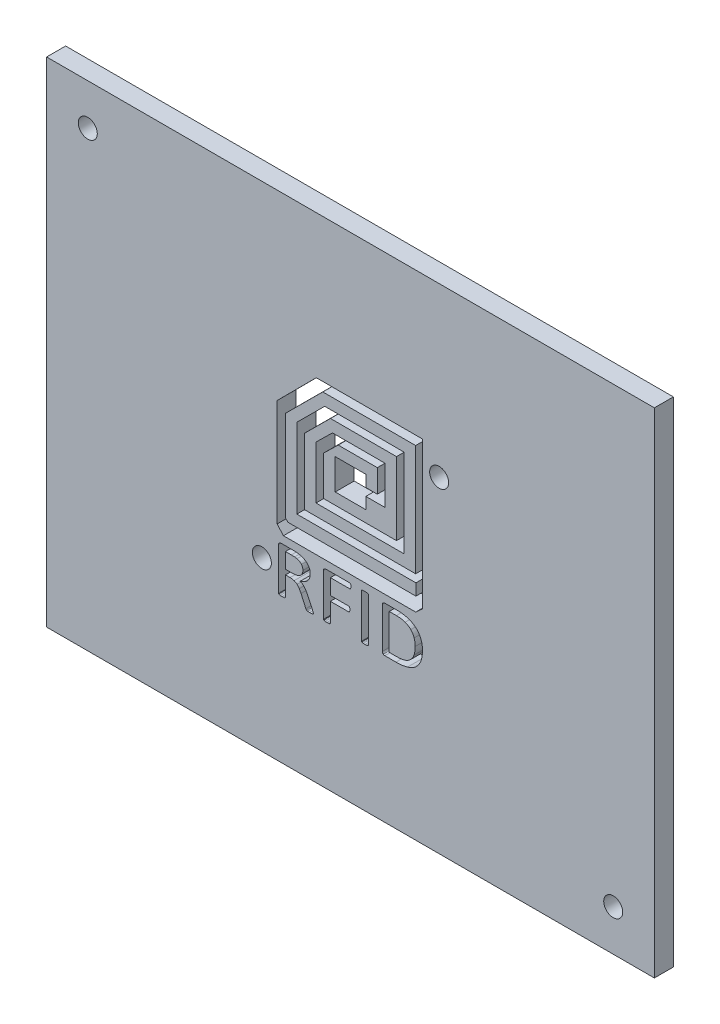
from build123d import *

# Parameters (mm, degrees)
CROQUIS1_W              = 96
CROQUIS1_H              = 78
SALIENTE_EXTRUIR2_DEPTH = 3
CROQUIS2_OUTSIDE_W      = 122.746
CROQUIS2_OUTSIDE_H      = 104.746
CROQUIS2_OUTSIDE_W_2    = 96
CROQUIS2_OUTSIDE_H_2    = 78
CROQUIS2_OUTSIDE_R      = 1.5
CORTAR_EXTRUIR1_DEPTH   = 62.919302322
CORTAR_EXTRUIR9_DEPTH   = 10


with BuildPart() as part:
    # Croquis1 → Saliente-Extruir2 (new body)
    with BuildSketch(Plane.XY):
        Rectangle(CROQUIS1_W, CROQUIS1_H)
    extrude(amount=-SALIENTE_EXTRUIR2_DEPTH)

    # Croquis2 outside → Cortar-Extruir1 (cut, through all)
    # profile 1 of 5: a face of its own
    with BuildSketch(Plane.XY):
        Rectangle(CROQUIS2_OUTSIDE_W, CROQUIS2_OUTSIDE_H)
        Rectangle(CROQUIS2_OUTSIDE_W_2, CROQUIS2_OUTSIDE_H_2, mode=Mode.SUBTRACT)
    # profile 2 of 5: a face of its own
    with BuildSketch(Plane.XY):
        with Locations((-14, -12.5)):
            Circle(CROQUIS2_OUTSIDE_R)
    # profile 3 of 5: a face of its own
    with BuildSketch(Plane.XY):
        with Locations((14, 12.5)):
            Circle(CROQUIS2_OUTSIDE_R)
    # profile 4 of 5: a face of its own
    with BuildSketch(Plane.XY):
        with Locations((-41.5, 32.5)):
            Circle(CROQUIS2_OUTSIDE_R)
    # profile 5 of 5: a face of its own
    with BuildSketch(Plane.XY):
        with Locations((41.5, -32.5)):
            Circle(CROQUIS2_OUTSIDE_R)
    extrude(amount=-CORTAR_EXTRUIR1_DEPTH, mode=Mode.SUBTRACT)

    # Sketch6 → Cortar-Extruir9 (cut)
    # profile 1 of 5: a face of its own
    with BuildSketch(Plane.XY):
        with BuildLine():
            Line((1.727462, -9.152641), (1.727462, -16.05162))
            add(Edge.make_bspline(
                [(1.727462, -16.05162), (1.727462, -16.081137), (1.738769, -16.106227), (1.755729, -16.128365)],
                knots=[0, 0, 0, 0, 1, 1, 1, 1], degree=3))
            add(Edge.make_bspline(
                [(1.755729, -16.128365), (1.77269, -16.150504), (1.801522, -16.171166), (1.843922, -16.185925)],
                knots=[0, 0, 0, 0, 1, 1, 1, 1], degree=3))
            add(Edge.make_bspline(
                [(1.843922, -16.185925), (1.886323, -16.198224), (1.942856, -16.203143), (2.014937, -16.210523)],
                knots=[0, 0, 0, 0, 1, 1, 1, 1], degree=3))
            add(Edge.make_bspline(
                [(2.014937, -16.210523), (2.0873, -16.222822), (2.177754, -16.230201), (2.279798, -16.230201)],
                knots=[0, 0, 0, 0, 1, 1, 1, 1], degree=3))
            add(Edge.make_bspline(
                [(2.279798, -16.230201), (2.386082, -16.230201), (2.471165, -16.222822), (2.539288, -16.210523)],
                knots=[0, 0, 0, 0, 1, 1, 1, 1], degree=3))
            add(Edge.make_bspline(
                [(2.539288, -16.210523), (2.611652, -16.203143), (2.667903, -16.198224), (2.710303, -16.185925)],
                knots=[0, 0, 0, 0, 1, 1, 1, 1], degree=3))
            add(Edge.make_bspline(
                [(2.710303, -16.185925), (2.752986, -16.171166), (2.781536, -16.150504), (2.798496, -16.128365)],
                knots=[0, 0, 0, 0, 1, 1, 1, 1], degree=3))
            add(Edge.make_bspline(
                [(2.798496, -16.128365), (2.815456, -16.106227), (2.826763, -16.081137), (2.826763, -16.05162)],
                knots=[0, 0, 0, 0, 1, 1, 1, 1], degree=3))
            Line((2.826763, -16.05162), (2.826763, -9.152641))
            add(Edge.make_bspline(
                [(2.826763, -9.152641), (2.826763, -9.123123), (2.815456, -9.098033), (2.798496, -9.075895)],
                knots=[0, 0, 0, 0, 1, 1, 1, 1], degree=3))
            add(Edge.make_bspline(
                [(2.798496, -9.075895), (2.781536, -9.053757), (2.752704, -9.034079), (2.710303, -9.023009)],
                knots=[0, 0, 0, 0, 1, 1, 1, 1], degree=3))
            add(Edge.make_bspline(
                [(2.710303, -9.023009), (2.66762, -9.008251), (2.611369, -8.99669), (2.539288, -8.98931)],
                knots=[0, 0, 0, 0, 1, 1, 1, 1], degree=3))
            Line((2.539288, -8.98931), (2.279798, -8.974551))
            add(Edge.make_bspline(
                [(2.279798, -8.974551), (2.182277, -8.974551), (2.092954, -8.977011), (2.02059, -8.98931)],
                knots=[0, 0, 0, 0, 1, 1, 1, 1], degree=3))
            add(Edge.make_bspline(
                [(2.02059, -8.98931), (1.952467, -8.99669), (1.896216, -9.008989), (1.849576, -9.023009)],
                knots=[0, 0, 0, 0, 1, 1, 1, 1], degree=3))
            add(Edge.make_bspline(
                [(1.849576, -9.023009), (1.806892, -9.035308), (1.77693, -9.053757), (1.755729, -9.075895)],
                knots=[0, 0, 0, 0, 1, 1, 1, 1], degree=3))
            add(Edge.make_bspline(
                [(1.755729, -9.075895), (1.738769, -9.098033), (1.727462, -9.123123), (1.727462, -9.152641)],
                knots=[0, 0, 0, 0, 1, 1, 1, 1], degree=3))
        make_face()
    # profile 2 of 5: a face of its own
    with BuildSketch(Plane.XY):
        with BuildLine():
            Line((-11.372982, -9.397514), (-11.372982, -16.051472))
            add(Edge.make_bspline(
                [(-11.372982, -16.051472), (-11.372982, -16.08099), (-11.367329, -16.10608), (-11.350369, -16.128218)],
                knots=[0, 0, 0, 0, 1, 1, 1, 1], degree=3))
            add(Edge.make_bspline(
                [(-11.350369, -16.128218), (-11.333408, -16.150356), (-11.299205, -16.171018), (-11.256522, -16.185777)],
                knots=[0, 0, 0, 0, 1, 1, 1, 1], degree=3))
            add(Edge.make_bspline(
                [(-11.256522, -16.185777), (-11.213839, -16.198076), (-11.159001, -16.202996), (-11.090878, -16.210375)],
                knots=[0, 0, 0, 0, 1, 1, 1, 1], degree=3))
            add(Edge.make_bspline(
                [(-11.090878, -16.210375), (-11.018515, -16.222674), (-10.932301, -16.230054), (-10.826017, -16.230054)],
                knots=[0, 0, 0, 0, 1, 1, 1, 1], degree=3))
            add(Edge.make_bspline(
                [(-10.826017, -16.230054), (-10.719734, -16.230054), (-10.628997, -16.222674), (-10.561156, -16.210375)],
                knots=[0, 0, 0, 0, 1, 1, 1, 1], degree=3))
            add(Edge.make_bspline(
                [(-10.561156, -16.210375), (-10.488793, -16.202996), (-10.433672, -16.198076), (-10.395512, -16.185777)],
                knots=[0, 0, 0, 0, 1, 1, 1, 1], degree=3))
            add(Edge.make_bspline(
                [(-10.395512, -16.185777), (-10.352829, -16.171018), (-10.324279, -16.150356), (-10.307319, -16.128218)],
                knots=[0, 0, 0, 0, 1, 1, 1, 1], degree=3))
            add(Edge.make_bspline(
                [(-10.307319, -16.128218), (-10.284706, -16.10608), (-10.274247, -16.08099), (-10.274247, -16.051472)],
                knots=[0, 0, 0, 0, 1, 1, 1, 1], degree=3))
            Line((-10.274247, -16.051472), (-10.274247, -12.991136))
            Line((-10.274247, -12.991136), (-9.539957, -12.991136))
            add(Edge.make_bspline(
                [(-9.539957, -12.991136), (-9.288947, -12.991136), (-9.078245, -13.025327), (-8.899542, -13.091987)],
                knots=[0, 0, 0, 0, 1, 1, 1, 1], degree=3))
            add(Edge.make_bspline(
                [(-8.899542, -13.091987), (-8.720895, -13.154958), (-8.562176, -13.242527), (-8.430255, -13.36104)],
                knots=[0, 0, 0, 0, 1, 1, 1, 1], degree=3))
            add(Edge.make_bspline(
                [(-8.430255, -13.36104), (-8.298248, -13.475913), (-8.187159, -13.616097), (-8.093482, -13.77901)],
                knots=[0, 0, 0, 0, 1, 1, 1, 1], degree=3))
            add(Edge.make_bspline(
                [(-8.093482, -13.77901), (-7.995679, -13.938159), (-7.901267, -14.114945), (-7.811944, -14.307498)],
                knots=[0, 0, 0, 0, 1, 1, 1, 1], degree=3))
            Line((-7.811944, -14.307498), (-7.055606, -15.998611))
            add(Edge.make_bspline(
                [(-7.055606, -15.998611), (-7.038646, -16.043133), (-7.016032, -16.079538), (-6.994832, -16.109056)],
                knots=[0, 0, 0, 0, 1, 1, 1, 1], degree=3))
            add(Edge.make_bspline(
                [(-6.994832, -16.109056), (-6.969392, -16.138574), (-6.938016, -16.167353), (-6.895333, -16.185802)],
                knots=[0, 0, 0, 0, 1, 1, 1, 1], degree=3))
            add(Edge.make_bspline(
                [(-6.895333, -16.185802), (-6.852932, -16.200561), (-6.797812, -16.20794), (-6.729688, -16.214582)],
                knots=[0, 0, 0, 0, 1, 1, 1, 1], degree=3))
            add(Edge.make_bspline(
                [(-6.729688, -16.214582), (-6.657325, -16.221961), (-6.564327, -16.22934), (-6.453521, -16.22934)],
                knots=[0, 0, 0, 0, 1, 1, 1, 1], degree=3))
            add(Edge.make_bspline(
                [(-6.453521, -16.22934), (-6.326037, -16.22934), (-6.220884, -16.221961), (-6.144365, -16.214582)],
                knots=[0, 0, 0, 0, 1, 1, 1, 1], degree=3))
            add(Edge.make_bspline(
                [(-6.144365, -16.214582), (-6.067762, -16.207202), (-6.01038, -16.199823), (-5.967697, -16.185802)],
                knots=[0, 0, 0, 0, 1, 1, 1, 1], degree=3))
            add(Edge.make_bspline(
                [(-5.967697, -16.185802), (-5.925297, -16.171043), (-5.897595, -16.150381), (-5.884875, -16.128242)],
                knots=[0, 0, 0, 0, 1, 1, 1, 1], degree=3))
            add(Edge.make_bspline(
                [(-5.884875, -16.128242), (-5.870742, -16.106104), (-5.867915, -16.081014), (-5.867915, -16.051497)],
                knots=[0, 0, 0, 0, 1, 1, 1, 1], degree=3))
            add(Edge.make_bspline(
                [(-5.867915, -16.051497), (-5.867915, -16.021979), (-5.873568, -15.978441), (-5.890528, -15.926539)],
                knots=[0, 0, 0, 0, 1, 1, 1, 1], degree=3))
            add(Edge.make_bspline(
                [(-5.890528, -15.926539), (-5.907489, -15.870947), (-5.94678, -15.776491), (-6.006423, -15.643071)],
                knots=[0, 0, 0, 0, 1, 1, 1, 1], degree=3))
            Line((-6.006423, -15.643071), (-6.746225, -14.062477))
            add(Edge.make_bspline(
                [(-6.746225, -14.062477), (-6.831308, -13.880944), (-6.914978, -13.716826), (-7.000062, -13.572436)],
                knots=[0, 0, 0, 0, 1, 1, 1, 1], degree=3))
            add(Edge.make_bspline(
                [(-7.000062, -13.572436), (-7.085145, -13.428045), (-7.178143, -13.299152), (-7.276229, -13.188092)],
                knots=[0, 0, 0, 0, 1, 1, 1, 1], degree=3))
            add(Edge.make_bspline(
                [(-7.276229, -13.188092), (-7.369793, -13.076909), (-7.469292, -12.982452), (-7.579873, -12.904624)],
                knots=[0, 0, 0, 0, 1, 1, 1, 1], degree=3))
            add(Edge.make_bspline(
                [(-7.579873, -12.904624), (-7.690396, -12.823205), (-7.819293, -12.759496), (-7.955286, -12.707594)],
                knots=[0, 0, 0, 0, 1, 1, 1, 1], degree=3))
            add(Edge.make_bspline(
                [(-7.955286, -12.707594), (-7.712755, -12.633554), (-7.488514, -12.541066), (-7.292794, -12.433745)],
                knots=[0, 0, 0, 0, 1, 1, 1, 1], degree=3))
            add(Edge.make_bspline(
                [(-7.292794, -12.433745), (-7.097187, -12.326251), (-6.930808, -12.203507), (-6.790378, -12.058994)],
                knots=[0, 0, 0, 0, 1, 1, 1, 1], degree=3))
            add(Edge.make_bspline(
                [(-6.790378, -12.058994), (-6.649891, -11.910914), (-6.542477, -11.73858), (-6.47017, -11.549741)],
                knots=[0, 0, 0, 0, 1, 1, 1, 1], degree=3))
            add(Edge.make_bspline(
                [(-6.47017, -11.549741), (-6.393567, -11.357139), (-6.359646, -11.141833), (-6.359646, -10.901166)],
                knots=[0, 0, 0, 0, 1, 1, 1, 1], degree=3))
            add(Edge.make_bspline(
                [(-6.359646, -10.901166), (-6.359646, -10.653095), (-6.401481, -10.427408), (-6.486565, -10.223761)],
                knots=[0, 0, 0, 0, 1, 1, 1, 1], degree=3))
            add(Edge.make_bspline(
                [(-6.486565, -10.223761), (-6.567408, -10.0164), (-6.690652, -9.835285), (-6.856466, -9.676062)],
                knots=[0, 0, 0, 0, 1, 1, 1, 1], degree=3))
            add(Edge.make_bspline(
                [(-6.856466, -9.676062), (-7.022392, -9.516913), (-7.228034, -9.385781), (-7.474804, -9.282125)],
                knots=[0, 0, 0, 0, 1, 1, 1, 1], degree=3))
            add(Edge.make_bspline(
                [(-7.474804, -9.282125), (-7.717335, -9.178567), (-7.994887, -9.099608), (-8.313993, -9.051642)],
                knots=[0, 0, 0, 0, 1, 1, 1, 1], degree=3))
            add(Edge.make_bspline(
                [(-8.313993, -9.051642), (-8.424516, -9.039343), (-8.554544, -9.029503), (-8.694918, -9.022862)],
                knots=[0, 0, 0, 0, 1, 1, 1, 1], degree=3))
            add(Edge.make_bspline(
                [(-8.694918, -9.022862), (-8.831164, -9.010563), (-8.999889, -9.008103), (-9.208358, -9.008103)],
                knots=[0, 0, 0, 0, 1, 1, 1, 1], degree=3))
            Line((-9.208358, -9.008103), (-10.964525, -9.008251))
            add(Edge.make_bspline(
                [(-10.964525, -9.008251), (-11.062329, -9.008251), (-11.15674, -9.035554), (-11.246064, -9.094836)],
                knots=[0, 0, 0, 0, 1, 1, 1, 1], degree=3))
            add(Edge.make_bspline(
                [(-11.246064, -9.094836), (-11.331147, -9.150427), (-11.372982, -9.253001), (-11.372982, -9.397514)],
                knots=[0, 0, 0, 0, 1, 1, 1, 1], degree=3))
        make_face()
        with BuildLine():
            Line((-10.274417, -9.796149), (-9.352434, -9.796149))
            add(Edge.make_bspline(
                [(-9.352434, -9.796149), (-9.135345, -9.796149), (-8.959835, -9.803529), (-8.827942, -9.815828)],
                knots=[0, 0, 0, 0, 1, 1, 1, 1], degree=3))
            add(Edge.make_bspline(
                [(-8.827942, -9.815828), (-8.691695, -9.828127), (-8.569865, -9.84264), (-8.463553, -9.868714)],
                knots=[0, 0, 0, 0, 1, 1, 1, 1], degree=3))
            add(Edge.make_bspline(
                [(-8.463553, -9.868714), (-8.123163, -9.953823), (-7.879474, -10.095261), (-7.734804, -10.29148)],
                knots=[0, 0, 0, 0, 1, 1, 1, 1], degree=3))
            add(Edge.make_bspline(
                [(-7.734804, -10.29148), (-7.590077, -10.484082), (-7.51941, -10.721133), (-7.51941, -11.002534)],
                knots=[0, 0, 0, 0, 1, 1, 1, 1], degree=3))
            add(Edge.make_bspline(
                [(-7.51941, -11.002534), (-7.51941, -11.176442), (-7.550786, -11.33965), (-7.618627, -11.487754)],
                knots=[0, 0, 0, 0, 1, 1, 1, 1], degree=3))
            add(Edge.make_bspline(
                [(-7.618627, -11.487754), (-7.68251, -11.635834), (-7.78738, -11.761014), (-7.92781, -11.872098)],
                knots=[0, 0, 0, 0, 1, 1, 1, 1], degree=3))
            add(Edge.make_bspline(
                [(-7.92781, -11.872098), (-8.068297, -11.979346), (-8.245078, -12.068636), (-8.457815, -12.131534)],
                knots=[0, 0, 0, 0, 1, 1, 1, 1], degree=3))
            add(Edge.make_bspline(
                [(-8.457815, -12.131534), (-8.666425, -12.190815), (-8.913788, -12.218119), (-9.203129, -12.218119)],
                knots=[0, 0, 0, 0, 1, 1, 1, 1], degree=3))
            Line((-9.203129, -12.218119), (-10.27419, -12.218119))
            Line((-10.27419, -12.218119), (-10.274417, -9.796149))
        make_face(mode=Mode.SUBTRACT)
    # profile 3 of 5: a face of its own
    with BuildSketch(Plane.XY):
        with BuildLine():
            Line((-4.278636, -9.397514), (-4.278636, -16.051472))
            add(Edge.make_bspline(
                [(-4.278636, -16.051472), (-4.278636, -16.0773), (-4.267329, -16.10239), (-4.250369, -16.128218)],
                knots=[0, 0, 0, 0, 1, 1, 1, 1], degree=3))
            add(Edge.make_bspline(
                [(-4.250369, -16.128218), (-4.233409, -16.150356), (-4.204576, -16.171018), (-4.162176, -16.185777)],
                knots=[0, 0, 0, 0, 1, 1, 1, 1], degree=3))
            add(Edge.make_bspline(
                [(-4.162176, -16.185777), (-4.119776, -16.198076), (-4.063242, -16.202996), (-3.991161, -16.210375)],
                knots=[0, 0, 0, 0, 1, 1, 1, 1], degree=3))
            add(Edge.make_bspline(
                [(-3.991161, -16.210375), (-3.918798, -16.222674), (-3.828344, -16.230054), (-3.7263, -16.230054)],
                knots=[0, 0, 0, 0, 1, 1, 1, 1], degree=3))
            add(Edge.make_bspline(
                [(-3.7263, -16.230054), (-3.615777, -16.230054), (-3.52928, -16.222674), (-3.461439, -16.210375)],
                knots=[0, 0, 0, 0, 1, 1, 1, 1], degree=3))
            add(Edge.make_bspline(
                [(-3.461439, -16.210375), (-3.393316, -16.202996), (-3.338478, -16.198076), (-3.295795, -16.185777)],
                knots=[0, 0, 0, 0, 1, 1, 1, 1], degree=3))
            add(Edge.make_bspline(
                [(-3.295795, -16.185777), (-3.253112, -16.171018), (-3.218909, -16.150356), (-3.201949, -16.128218)],
                knots=[0, 0, 0, 0, 1, 1, 1, 1], degree=3))
            add(Edge.make_bspline(
                [(-3.201949, -16.128218), (-3.184989, -16.10239), (-3.179335, -16.0773), (-3.179335, -16.051472)],
                knots=[0, 0, 0, 0, 1, 1, 1, 1], degree=3))
            Line((-3.179335, -16.051472), (-3.179335, -13.058386))
            Line((-3.179335, -13.058386), (-0.319515, -13.058386))
            add(Edge.make_bspline(
                [(-0.319515, -13.058386), (-0.289834, -13.058386), (-0.262133, -13.048547), (-0.236693, -13.033788)],
                knots=[0, 0, 0, 0, 1, 1, 1, 1], degree=3))
            add(Edge.make_bspline(
                [(-0.236693, -13.033788), (-0.207012, -13.01411), (-0.180724, -12.991234), (-0.159241, -12.961716)],
                knots=[0, 0, 0, 0, 1, 1, 1, 1], degree=3))
            add(Edge.make_bspline(
                [(-0.159241, -12.961716), (-0.136628, -12.928509), (-0.123625, -12.889644), (-0.115145, -12.841678)],
                knots=[0, 0, 0, 0, 1, 1, 1, 1], degree=3))
            add(Edge.make_bspline(
                [(-0.115145, -12.841678), (-0.106665, -12.789776), (-0.103838, -12.724592), (-0.103838, -12.654241)],
                knots=[0, 0, 0, 0, 1, 1, 1, 1], degree=3))
            add(Edge.make_bspline(
                [(-0.103838, -12.654241), (-0.103838, -12.576512), (-0.106382, -12.515016), (-0.115145, -12.466804)],
                knots=[0, 0, 0, 0, 1, 1, 1, 1], degree=3))
            add(Edge.make_bspline(
                [(-0.115145, -12.466804), (-0.123625, -12.414903), (-0.137758, -12.376284), (-0.159241, -12.346766)],
                knots=[0, 0, 0, 0, 1, 1, 1, 1], degree=3))
            add(Edge.make_bspline(
                [(-0.159241, -12.346766), (-0.181855, -12.317249), (-0.20673, -12.295356), (-0.236693, -12.284287)],
                knots=[0, 0, 0, 0, 1, 1, 1, 1], degree=3))
            add(Edge.make_bspline(
                [(-0.236693, -12.284287), (-0.262133, -12.269528), (-0.289834, -12.259689), (-0.319515, -12.259689)],
                knots=[0, 0, 0, 0, 1, 1, 1, 1], degree=3))
            Line((-0.319515, -12.259689), (-3.179335, -12.259689))
            Line((-3.179335, -12.259689), (-3.179335, -9.819124))
            Line((-3.179335, -9.819124), (-0.153899, -9.819124))
            add(Edge.make_bspline(
                [(-0.153899, -9.819124), (-0.124219, -9.819124), (-0.096517, -9.809285), (-0.071077, -9.794526)],
                knots=[0, 0, 0, 0, 1, 1, 1, 1], degree=3))
            add(Edge.make_bspline(
                [(-0.071077, -9.794526), (-0.041396, -9.779767), (-0.015108, -9.756891), (0.006092, -9.727373)],
                knots=[0, 0, 0, 0, 1, 1, 1, 1], degree=3))
            add(Edge.make_bspline(
                [(0.006092, -9.727373), (0.028705, -9.694166), (0.041708, -9.654317), (0.050188, -9.602416)],
                knots=[0, 0, 0, 0, 1, 1, 1, 1], degree=3))
            add(Edge.make_bspline(
                [(0.050188, -9.602416), (0.058668, -9.550514), (0.061495, -9.485329), (0.061495, -9.414979)],
                knots=[0, 0, 0, 0, 1, 1, 1, 1], degree=3))
            add(Edge.make_bspline(
                [(0.061495, -9.414979), (0.061495, -9.344628), (0.058979, -9.284363), (0.050188, -9.232462)],
                knots=[0, 0, 0, 0, 1, 1, 1, 1], degree=3))
            add(Edge.make_bspline(
                [(0.050188, -9.232462), (0.041708, -9.17687), (0.027575, -9.136037), (0.006092, -9.10283)],
                knots=[0, 0, 0, 0, 1, 1, 1, 1], degree=3))
            add(Edge.make_bspline(
                [(0.006092, -9.10283), (-0.016522, -9.069377), (-0.041396, -9.045517), (-0.071077, -9.030758)],
                knots=[0, 0, 0, 0, 1, 1, 1, 1], degree=3))
            add(Edge.make_bspline(
                [(-0.071077, -9.030758), (-0.096517, -9.015999), (-0.124219, -9.00616), (-0.153899, -9.00616)],
                knots=[0, 0, 0, 0, 1, 1, 1, 1], degree=3))
            Line((-0.153899, -9.00616), (-3.870179, -9.008251))
            add(Edge.make_bspline(
                [(-3.870179, -9.008251), (-3.967982, -9.008251), (-4.062394, -9.035554), (-4.151717, -9.094836)],
                knots=[0, 0, 0, 0, 1, 1, 1, 1], degree=3))
            add(Edge.make_bspline(
                [(-4.151717, -9.094836), (-4.236801, -9.150427), (-4.278636, -9.253001), (-4.278636, -9.397514)],
                knots=[0, 0, 0, 0, 1, 1, 1, 1], degree=3))
        make_face()
    # profile 4 of 5: a face of its own
    with BuildSketch(Plane.XY):
        with BuildLine():
            Line((5.024035, -9.397514), (5.024035, -15.806451))
            add(Edge.make_bspline(
                [(5.024035, -15.806451), (5.024035, -15.950842), (5.06587, -16.049972), (5.150954, -16.10913)],
                knots=[0, 0, 0, 0, 1, 1, 1, 1], degree=3))
            add(Edge.make_bspline(
                [(5.150954, -16.10913), (5.240277, -16.164721), (5.334689, -16.195715), (5.432492, -16.195715)],
                knots=[0, 0, 0, 0, 1, 1, 1, 1], degree=3))
            Line((5.432492, -16.195715), (7.177098, -16.195715))
            add(Edge.make_bspline(
                [(7.177098, -16.195715), (7.883404, -16.195715), (8.493941, -16.117001), (9.004526, -15.965231)],
                knots=[0, 0, 0, 0, 1, 1, 1, 1], degree=3))
            add(Edge.make_bspline(
                [(9.004526, -15.965231), (9.515083, -15.813462), (9.94751, -15.586644), (10.296409, -15.28303)],
                knots=[0, 0, 0, 0, 1, 1, 1, 1], degree=3))
            add(Edge.make_bspline(
                [(10.296409, -15.28303), (10.649548, -14.975727), (10.913985, -14.59281), (11.096928, -14.129999)],
                knots=[0, 0, 0, 0, 1, 1, 1, 1], degree=3))
            add(Edge.make_bspline(
                [(11.096928, -14.129999), (11.279815, -13.663473), (11.373096, -13.118578), (11.373096, -12.496543)],
                knots=[0, 0, 0, 0, 1, 1, 1, 1], degree=3))
            add(Edge.make_bspline(
                [(11.373096, -12.496543), (11.373096, -11.955953), (11.288013, -11.470339), (11.113606, -11.040833)],
                knots=[0, 0, 0, 0, 1, 1, 1, 1], degree=3))
            add(Edge.make_bspline(
                [(11.113606, -11.040833), (10.943439, -10.611327), (10.687849, -10.245358), (10.351727, -9.945459)],
                knots=[0, 0, 0, 0, 1, 1, 1, 1], degree=3))
            add(Edge.make_bspline(
                [(10.351727, -9.945459), (10.019846, -9.641846), (9.60859, -9.412839), (9.11505, -9.25364)],
                knots=[0, 0, 0, 0, 1, 1, 1, 1], degree=3))
            add(Edge.make_bspline(
                [(9.11505, -9.25364), (8.621481, -9.090802), (8.013488, -9.008644), (7.298674, -9.008644)],
                knots=[0, 0, 0, 0, 1, 1, 1, 1], degree=3))
            Line((7.298674, -9.008644), (5.432492, -9.008251))
            add(Edge.make_bspline(
                [(5.432492, -9.008251), (5.334689, -9.008251), (5.240277, -9.035554), (5.150954, -9.094836)],
                knots=[0, 0, 0, 0, 1, 1, 1, 1], degree=3))
            add(Edge.make_bspline(
                [(5.150954, -9.094836), (5.06587, -9.150427), (5.024035, -9.253001), (5.024035, -9.397514)],
                knots=[0, 0, 0, 0, 1, 1, 1, 1], degree=3))
        make_face()
        with BuildLine():
            Line((6.117089, -9.801069), (7.237844, -9.801069))
            add(Edge.make_bspline(
                [(7.237844, -9.801069), (7.807987, -9.801069), (8.27295, -9.870681), (8.634625, -10.007692)],
                knots=[0, 0, 0, 0, 1, 1, 1, 1], degree=3))
            add(Edge.make_bspline(
                [(8.634625, -10.007692), (8.996272, -10.144703), (9.294969, -10.335043), (9.52899, -10.579399)],
                knots=[0, 0, 0, 0, 1, 1, 1, 1], degree=3))
            add(Edge.make_bspline(
                [(9.52899, -10.579399), (9.767281, -10.823903), (9.942846, -11.116841), (10.053483, -11.453785)],
                knots=[0, 0, 0, 0, 1, 1, 1, 1], degree=3))
            add(Edge.make_bspline(
                [(10.053483, -11.453785), (10.164007, -11.787014), (10.219127, -12.145973), (10.219127, -12.534744)],
                knots=[0, 0, 0, 0, 1, 1, 1, 1], degree=3))
            add(Edge.make_bspline(
                [(10.219127, -12.534744), (10.219127, -13.023482), (10.154679, -13.448732), (10.031435, -13.807888)],
                knots=[0, 0, 0, 0, 1, 1, 1, 1], degree=3))
            add(Edge.make_bspline(
                [(10.031435, -13.807888), (9.912431, -14.163329), (9.732908, -14.45971), (9.490378, -14.696688)],
                knots=[0, 0, 0, 0, 1, 1, 1, 1], degree=3))
            add(Edge.make_bspline(
                [(9.490378, -14.696688), (9.247848, -14.933566), (8.946607, -15.110377), (8.58496, -15.225151)],
                knots=[0, 0, 0, 0, 1, 1, 1, 1], degree=3))
            add(Edge.make_bspline(
                [(8.58496, -15.225151), (8.223285, -15.340024), (7.776498, -15.393402), (7.248896, -15.393402)],
                knots=[0, 0, 0, 0, 1, 1, 1, 1], degree=3))
            Line((7.248896, -15.393402), (6.117117, -15.393402))
            Line((6.117117, -15.393402), (6.117089, -9.801069))
        make_face(mode=Mode.SUBTRACT)
    # profile 5 of 5: a face of its own
    with BuildSketch(Plane.XY):
        Polygon((-11.593863529, -6.684693432), (-11.593863529, 10.204676568), (-5.400733529, 16.418956568), (11.406136471, 16.418956568), (11.406136471, -6.789863432), (10.299266471, -7.791563432), (-10.592163529, -7.791563432), align=None)
        with BuildLine():
            Line((10.329675, -3.77368), (-8.473675, -3.77368))
            Line((-8.473675, -3.77368), (-8.473675, 8.80068))
            Line((-8.473675, 8.80068), (-4.071285, 13.17368))
            Line((-4.071285, 13.17368), (8.473695, 13.17368))
            Line((8.473695, 13.17368), (8.473695, -0.74737))
            Line((8.473695, -0.74737), (-5.447365, -0.74737))
            Line((-5.447365, -0.74737), (-5.447365, 7.6003))
            add(Edge.make_bspline(
                [(-5.447365, 7.6003), (-4.582265, 8.44932), (-3.717165, 9.29834), (-2.852085, 10.14738)],
                knots=[0, 0, 0, 0, 1, 1, 1, 1], degree=3))
            Line((-2.852085, 10.14738), (5.447375, 10.14738))
            Line((5.447375, 10.14738), (5.447375, 4.09473))
            Line((5.447375, 4.09473), (2.421055, 4.09473))
            Line((2.421055, 4.09473), (2.421055, 2.27895))
            Line((2.421055, 2.27895), (-2.421055, 2.27895))
            Line((-2.421055, 2.27895), (-2.421055, 7.12106))
            Line((-2.421055, 7.12106), (2.421055, 7.12106))
            Line((2.421055, 7.12106), (2.421055, 5.30527))
            Line((2.421055, 5.30527), (4.236855, 5.30527))
            Line((4.236855, 5.30527), (4.236855, 8.93685))
            Line((4.236855, 8.93685), (-1.941565, 8.93685))
            add(Edge.make_bspline(
                [(-1.941565, 8.93685), (-2.706665, 8.18977), (-3.471745, 7.44267), (-4.236845, 6.69558)],
                knots=[0, 0, 0, 0, 1, 1, 1, 1], degree=3))
            Line((-4.236845, 6.69558), (-4.236845, 0.46316))
            Line((-4.236845, 0.46316), (7.263165, 0.46316))
            Line((7.263165, 0.46316), (7.263165, 11.96316))
            Line((7.263165, 11.96316), (-3.162435, 11.96316))
            Line((-3.162435, 11.96316), (-7.263145, 7.89387))
            Line((-7.263145, 7.89387), (-7.263145, -2.56316))
            Line((-7.263145, -2.56316), (10.289485, -2.56316))
            Line((10.289485, -2.56316), (10.289485, 14.98948))
            Line((10.289485, 14.98948), (-4.377315, 14.98948))
            add(Edge.make_bspline(
                [(-4.377315, 14.98948), (-8.318755, 11.06284), (-10.289465, 9.09951)],
                knots=[0, 0, 0, 1, 1, 1], degree=2))
            Line((-10.289465, 9.09951), (-10.289465, -5.18596))
            Line((-10.289465, -5.18596), (-9.877935, -5.59749))
            Line((-9.877935, -5.59749), (10.329675, -5.59749))
            Line((10.329675, -5.59749), (10.329675, -3.77368))
        make_face(mode=Mode.SUBTRACT)
    extrude(amount=-CORTAR_EXTRUIR9_DEPTH, mode=Mode.SUBTRACT)


with BuildPart() as cortar_extruir9_piece_1:
    # of the separate pieces the step leaves, piece 1, a body of its own (cortar_extruir9_pieces)
    add(part.part.solids().sort_by_distance((-48, -39, 0))[0])


with BuildPart() as cortar_extruir9_piece_2:
    # of the separate pieces the step leaves, piece 2, a body of its own (cortar_extruir9_pieces)
    add(part.part.solids().sort_by_distance((10.329675, -5.59749, 0))[0])


with BuildPart() as cortar_extruir9_piece_3:
    # of the separate pieces the step leaves, piece 3, a body of its own (cortar_extruir9_pieces)
    add(part.part.solids().sort_by_distance((6.117089, -9.801069, 0))[0])


with BuildPart() as cortar_extruir9_piece_4:
    # of the separate pieces the step leaves, piece 4, a body of its own (cortar_extruir9_pieces)
    add(part.part.solids().sort_by_distance((-10.274417, -9.796149, 0))[0])


solid = Compound([cortar_extruir9_piece_1.part, cortar_extruir9_piece_2.part, cortar_extruir9_piece_3.part, cortar_extruir9_piece_4.part])
